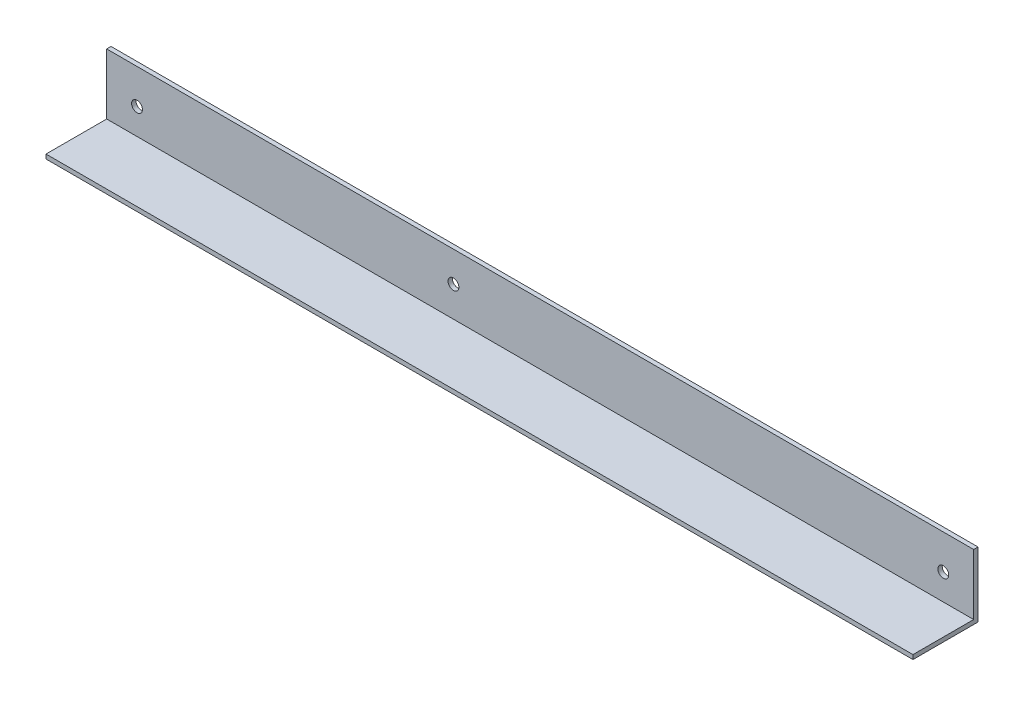
from build123d import *

# Parameters (mm, degrees)
SKETCH_1_W      = 200
SKETCH_1_H      = 15
EXTRUDE_1_DEPTH = 1
SKETCH_2_W      = 200
SKETCH_2_H      = 1
EXTRUDE_2_DEPTH = 14
M3X0_5_1_D      = 2.5
M3X0_5_2_D      = 2.5
M3X0_5_3_D      = 2.5


with BuildPart() as part:
    # ｽｹｯﾁ1 → ﾎﾞｽ - 押し出し1 (new body)
    with BuildSketch(Plane.XY):
        with Locations((100, 7.5)):
            Rectangle(SKETCH_1_W, SKETCH_1_H)
    extrude(amount=EXTRUDE_1_DEPTH)

    # ｽｹｯﾁ2 → ﾎﾞｽ - 押し出し2 (add)
    with BuildSketch(Plane.XY.offset(1)):
        with Locations((100, 0.5)):
            Rectangle(SKETCH_2_W, SKETCH_2_H)
    extrude(amount=EXTRUDE_2_DEPTH)

    # M3x0.5 ねじ穴1 (through all)
    with Locations(Plane(origin=(0, 0, 0), x_dir=(-1, 0, 0), z_dir=(0, 0, -1))):
        with Locations((-193, 7)):
            Hole(M3X0_5_1_D / 2)

    # M3x0.5 ねじ穴2 (through all)
    with Locations(Plane.XY.offset(1)):
        with Locations((80, 8)):
            Hole(M3X0_5_2_D / 2)

    # M3x0.5 ねじ穴3 (through all)
    with Locations(Plane(origin=(0, 0, 0), x_dir=(-1, 0, 0), z_dir=(0, 0, -1))):
        with Locations((-7, 7)):
            Hole(M3X0_5_3_D / 2)


solid = part.part
